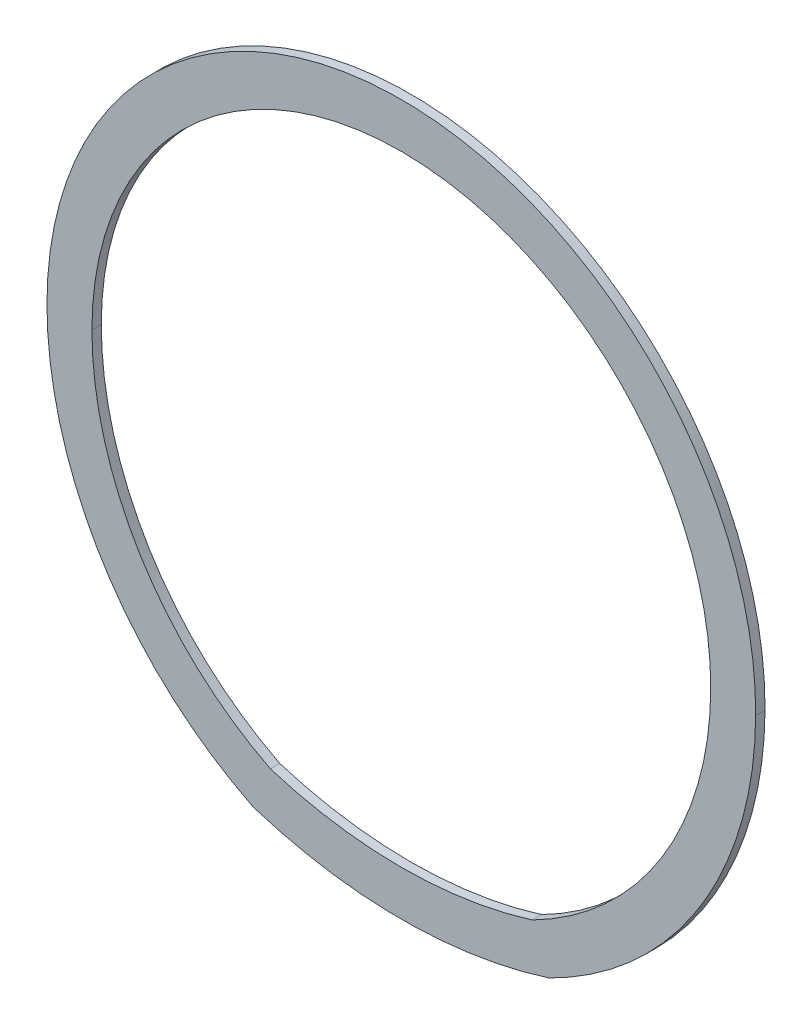
from build123d import *

# Parameters (mm, degrees)
BOSS_EXTRUDE1_DEPTH = 1.5875


with BuildPart() as part:
    # Sketch2 → Boss-Extrude1 (new, symmetric)
    with BuildSketch(Plane.XY):
        with BuildLine():
            ThreePointArc((-120.098895727, 19.05), (0.406748907, 139.2017743), (120.203613722, 18.343301545))
            ThreePointArc((120.203613722, 18.343301545), (101.067699546, -47.629728931), (50.138751442, -93.726))
            ThreePointArc((50.138751442, -93.726), (0.040174098, -101.514794876), (-50.058403246, -93.726))
            ThreePointArc((-50.058403246, -93.726), (-101.163912713, -47.327889321), (-120.098895727, 19.05))
        make_face()
        with BuildLine():
            ThreePointArc((-104.858895727, 19.05), (0.361930242, 123.961840203), (104.963877332, 18.432938489))
            ThreePointArc((104.963877332, 18.432938489), (88.446745877, -39.065849025), (44.40486057, -79.553359885))
            ThreePointArc((44.40486057, -79.553359885), (0.040463589, -86.274794876), (-44.323959374, -79.553531384))
            ThreePointArc((-44.323959374, -79.553531384), (-88.517658334, -38.801393502), (-104.858895727, 19.05))
        make_face(mode=Mode.SUBTRACT)
    extrude(amount=BOSS_EXTRUDE1_DEPTH, both=True)


solid = part.part
